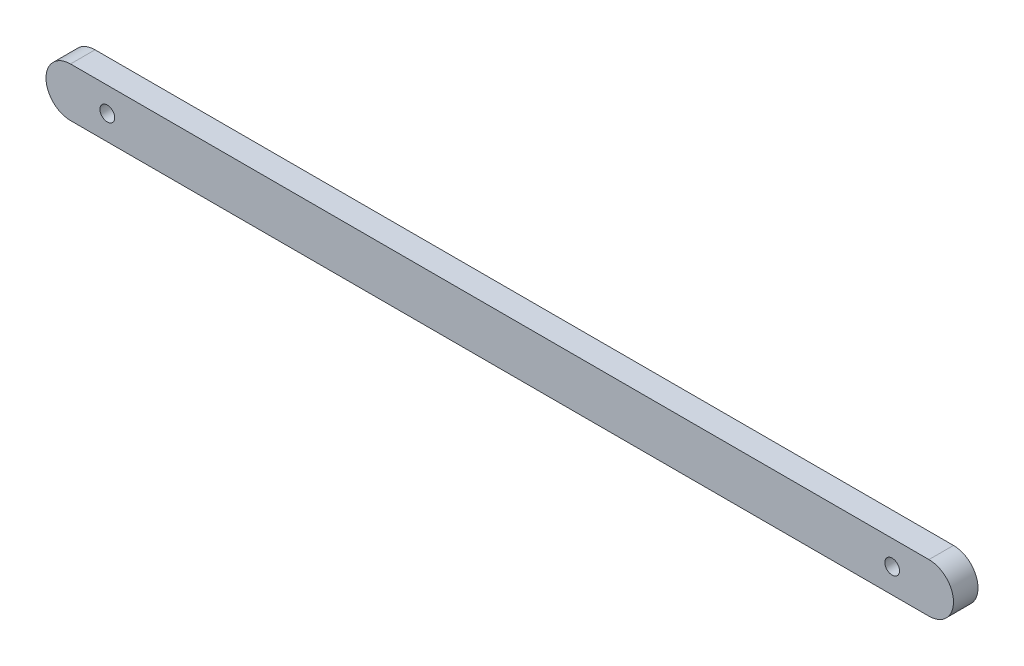
from build123d import *

# Parameters (mm, degrees)
BOSS_EXTRUDE2_DEPTH = 10
SKETCH3_R           = 3
CUT_EXTRUDE2_DEPTH  = 186.539753153


with BuildPart() as part:
    # Sketch1 → Boss-Extrude2 (new body)
    with BuildSketch(Plane.XY):
        with BuildLine():
            Line((-175, 10), (175, 10))
            ThreePointArc((175, 10), (185, 0), (175, -10))
            Line((175, -10), (-175, -10))
            ThreePointArc((-175, -10), (-185, 0), (-175, 10))
        make_face()
    extrude(amount=BOSS_EXTRUDE2_DEPTH)

    # Sketch3 → Cut-Extrude2 (cut, through all)
    with BuildSketch(Plane.XY.offset(10)):
        with Locations((-160, 0)):
            Circle(SKETCH3_R)
        with Locations(Location((160, 0, 0), (0, 0, 180))):
            Circle(SKETCH3_R)
    extrude(amount=-CUT_EXTRUDE2_DEPTH, mode=Mode.SUBTRACT)


solid = part.part
